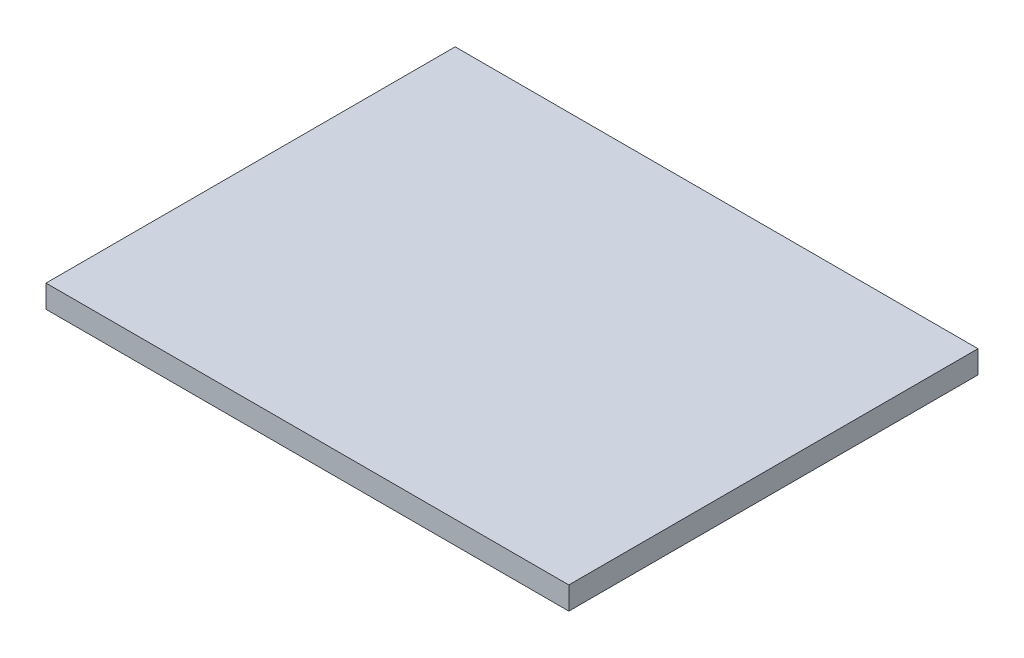
from build123d import *

# Parameters (mm, degrees)
SKETCH1_W           = 115
SKETCH1_H           = 90
BOSS_EXTRUDE1_DEPTH = 5


with BuildPart() as part:
    # Sketch1 → Boss-Extrude1 (new body)
    with BuildSketch(Plane(origin=(0, 0, 0), x_dir=(1, 0, 0), z_dir=(0, 1, 0))):
        Rectangle(SKETCH1_W, SKETCH1_H)
    extrude(amount=BOSS_EXTRUDE1_DEPTH)


solid = part.part
